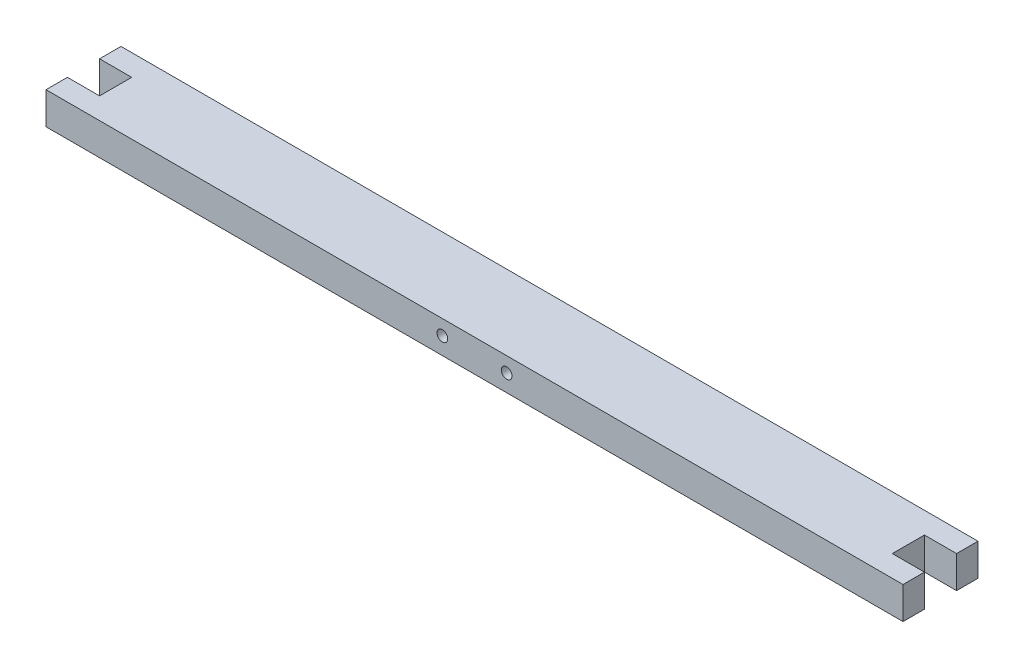
from build123d import *

# Parameters (mm, degrees)
EXTRUDE_1_DEPTH     = 15
SKETCH_4_R          = 2.5
CUT_EXTRUDE_1_DEPTH = 35


with BuildPart() as part:
    # 草图3 → 凸台-拉伸1 (new body)
    with BuildSketch(Plane(origin=(0, 0, 0), x_dir=(1, 0, 0), z_dir=(0, 1, 0))):
        Polygon((0, 0), (400, 0), (400, 10), (385, 10), (385, 25), (400, 25), (400, 35), (0, 35), (0, 25), (15, 25), (15, 10), (0, 10), align=None)
    extrude(amount=EXTRUDE_1_DEPTH)

    # 草图4 → 切除-拉伸1 (cut)
    with BuildSketch(Plane.XY):
        with Locations((185, 8)):
            Circle(SKETCH_4_R)
        with Locations((215, 8)):
            Circle(SKETCH_4_R)
    extrude(amount=-CUT_EXTRUDE_1_DEPTH, mode=Mode.SUBTRACT)


solid = part.part
